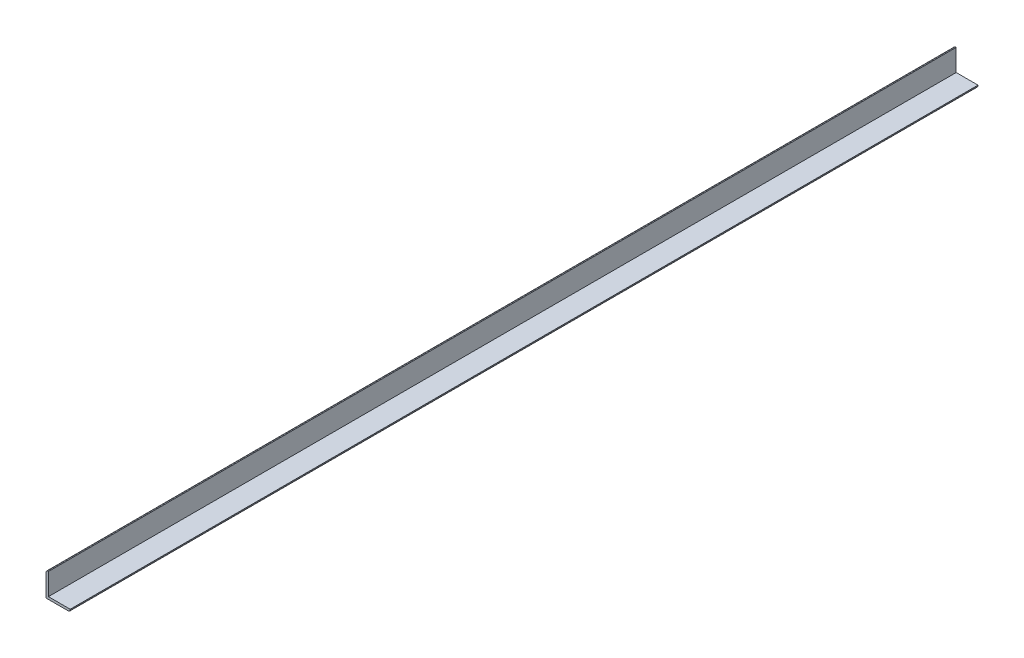
from build123d import *

# Parameters (mm, degrees)
EXTRUDE_1_DEPTH = 1500


with BuildPart() as part:
    # Эскиз1 → Бобышка-Вытянуть1 (new body)
    with BuildSketch(Plane.XY):
        with BuildLine():
            Line((0, 0), (37, 0))
            ThreePointArc((37, 0), (39.121320344, 0.878679656), (40, 3))
            Line((40, 3), (40, 4))
            Line((40, 4), (4, 4))
            Line((4, 4), (4, 40))
            Line((4, 40), (3, 40))
            ThreePointArc((3, 40), (0.878679656, 39.121320344), (0, 37))
            Line((0, 37), (0, 0))
        make_face()
    extrude(amount=EXTRUDE_1_DEPTH)


solid = part.part
